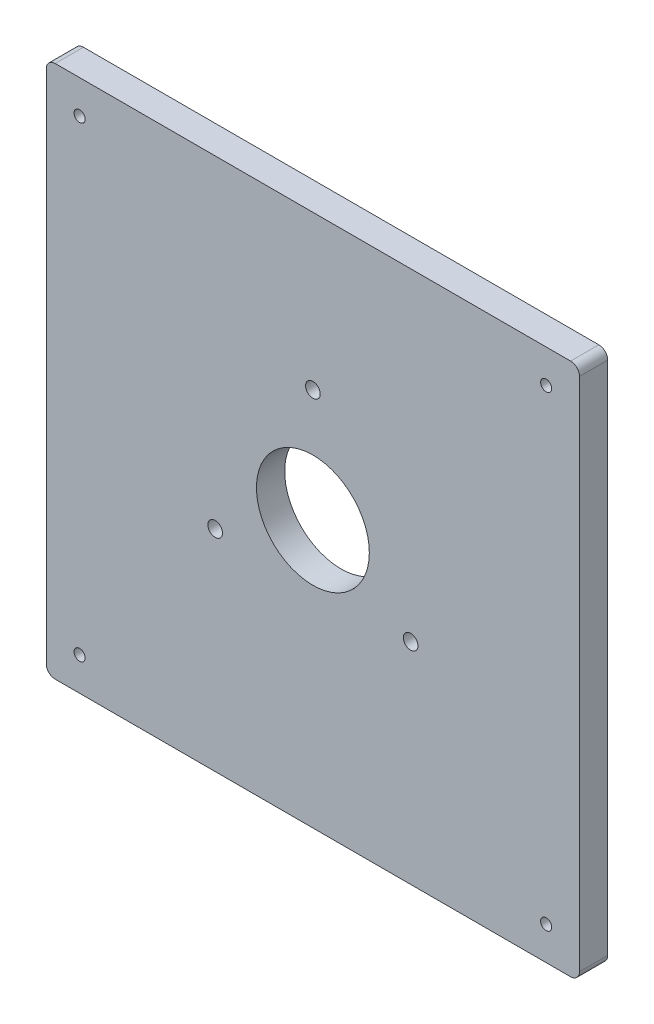
from build123d import *

# Parameters (mm, degrees)
ESQUISSE1_W             = 120
ESQUISSE1_H             = 120
ESQUISSE1_R             = 1.25
ESQUISSE1_R_2           = 12.7
BOSS_EXTRU_1_DEPTH      = 6.35
CONG_1_R                = 2
ESQUISSE2_R             = 1.65
ENL_V_MAT_EXTRU_1_DEPTH = 170.824387236


with BuildPart() as part:
    # Esquisse1 → Boss.-Extru.1 (new body)
    with BuildSketch(Plane.XY):
        with Locations((60, 60)):
            Rectangle(ESQUISSE1_W, ESQUISSE1_H)
        with Locations((7.5, 112.5)):
            Circle(ESQUISSE1_R, mode=Mode.SUBTRACT)
        with Locations(Location((112.5, 112.5, 0), (0, 0, 180))):
            Circle(ESQUISSE1_R, mode=Mode.SUBTRACT)
        with Locations((112.5, 7.5)):
            Circle(ESQUISSE1_R, mode=Mode.SUBTRACT)
        with Locations(Location((7.5, 7.5, 0), (0, 0, 180))):
            Circle(ESQUISSE1_R, mode=Mode.SUBTRACT)
        with Locations((60, 60)):
            Circle(ESQUISSE1_R_2, mode=Mode.SUBTRACT)
    extrude(amount=BOSS_EXTRU_1_DEPTH)

    # Congé1
    cong_1_edges = [part.edges().sort_by_distance(p)[0] for p in [
        (0, 120, 3.175),
        (120, 120, 3.175),
        (120, 0, 3.175),
        (0, 0, 3.175),
    ]]
    fillet(cong_1_edges, radius=CONG_1_R)

    # Esquisse2 → Enlèv. mat.-Extru.1 (cut, through all)
    with BuildSketch(Plane.XY.offset(6.35)):
        with Locations((60, 85.4)):
            Circle(ESQUISSE2_R)
        with Locations((38.002954744, 47.3)):
            Circle(ESQUISSE2_R)
        with Locations((81.997045256, 47.3)):
            Circle(ESQUISSE2_R)
    extrude(amount=-ENL_V_MAT_EXTRU_1_DEPTH, mode=Mode.SUBTRACT)


solid = part.part
